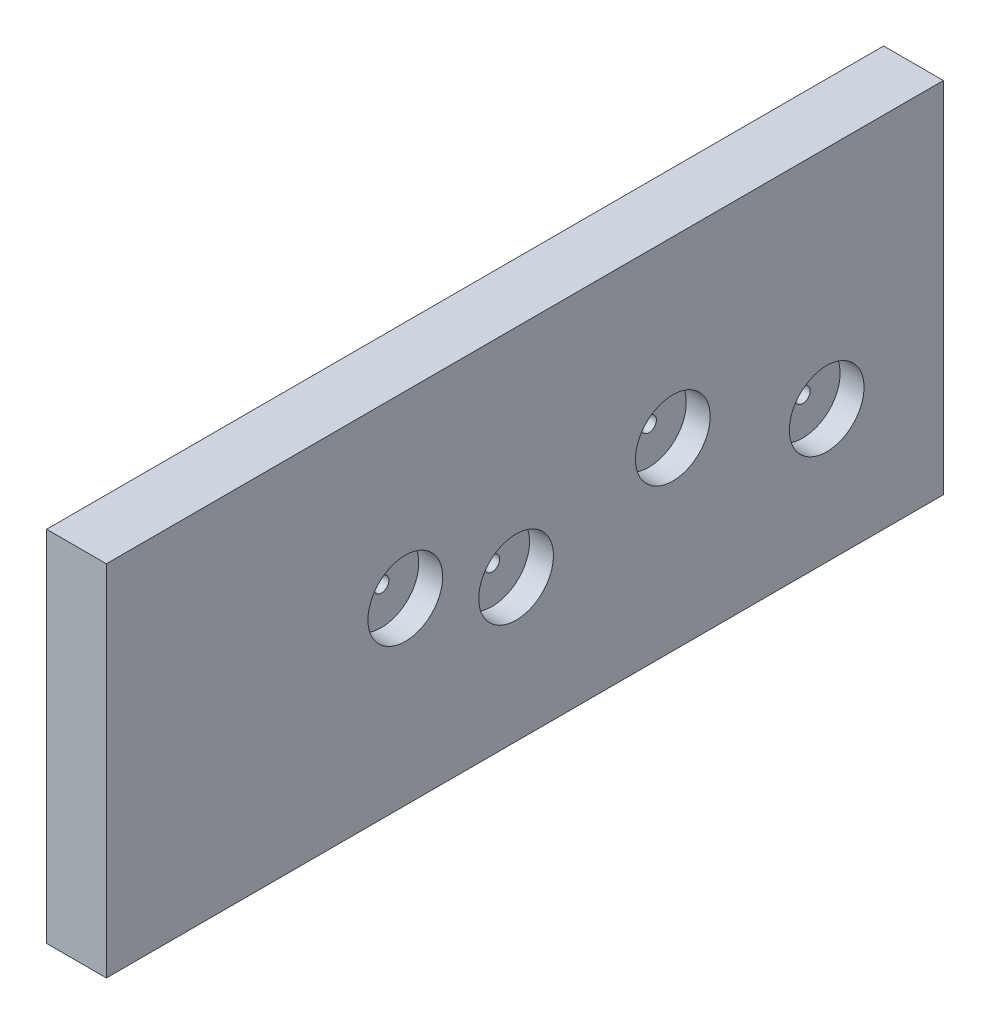
from build123d import *

# Parameters (mm, degrees)
SKETCH1_W                       = 177.8
SKETCH1_H                       = 76.2
SKETCH1_R                       = 1.5875
BOSS_EXTRUDE1_DEPTH             = 12.7
SKETCH2_R                       = 7.9375
CUT_EXTRUDE1_DEPTH              = 5.08
F_1_4_0_25_DIAMETER_HOLE1_D     = 6.35
F_1_4_0_25_DIAMETER_HOLE1_DEPTH = 38.1
F_1_4_0_25_DIAMETER_HOLE1_TIP   = 1.907732465


with BuildPart() as part:
    # Sketch1 → Boss-Extrude1 (new body)
    with BuildSketch(Plane(origin=(0, 0, 0), x_dir=(0, 0, -1), z_dir=(1, 0, 0))):
        with Locations((-12.7, 0)):
            Rectangle(SKETCH1_W, SKETCH1_H)
        with Locations((18.72253158, 1.096077429)):
            Circle(SKETCH1_R, mode=Mode.SUBTRACT)
        with Locations((-38.1, 0)):
            Circle(SKETCH1_R, mode=Mode.SUBTRACT)
        with Locations((-14.571224015, -7.860160654)):
            Circle(SKETCH1_R, mode=Mode.SUBTRACT)
        with Locations((51.408255992, -9.873506971)):
            Circle(SKETCH1_R, mode=Mode.SUBTRACT)
    extrude(amount=BOSS_EXTRUDE1_DEPTH)

    # Sketch2 → Cut-Extrude1 (cut)
    with BuildSketch(Plane.ZY.offset(-12.7)):
        with Locations((38.1, 0)):
            Circle(SKETCH2_R)
        with Locations((14.571224015, -7.860160654)):
            Circle(SKETCH2_R)
        with Locations((-18.72253158, 1.096077429)):
            Circle(SKETCH2_R)
        with Locations((-51.408255992, -9.873506971)):
            Circle(SKETCH2_R)
    extrude(amount=CUT_EXTRUDE1_DEPTH, mode=Mode.SUBTRACT)

    # 1/4 (0.25) Diameter Hole1
    with Locations(Plane.XZ.offset(38.1)):
        with Locations((6.35, -63.5), (6.35, 0), (6.35, 57.15)):
            Hole(F_1_4_0_25_DIAMETER_HOLE1_D / 2, depth=F_1_4_0_25_DIAMETER_HOLE1_DEPTH)
            with Locations((0, 0, -(F_1_4_0_25_DIAMETER_HOLE1_DEPTH + F_1_4_0_25_DIAMETER_HOLE1_TIP / 2))):  # 118° drill point
                Cone(0, F_1_4_0_25_DIAMETER_HOLE1_D / 2, F_1_4_0_25_DIAMETER_HOLE1_TIP, mode=Mode.SUBTRACT)


solid = part.part
